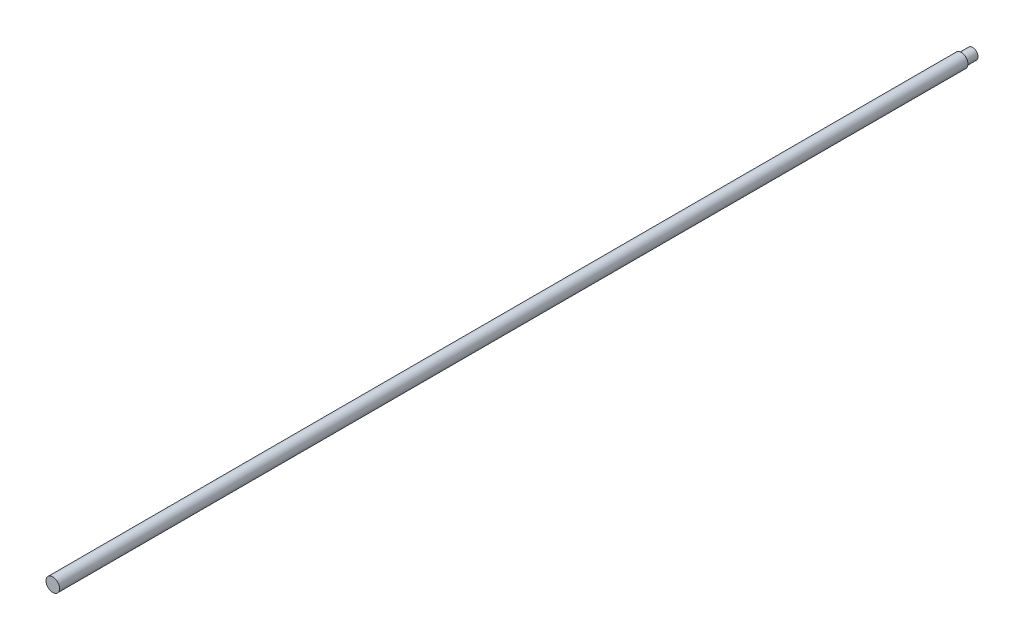
from build123d import *

# Parameters (mm, degrees)
ESQUISSE1_R               = 2.5
BOSS_EXTRU_1_DEPTH        = 340
ESQUISSE2_OUTSIDE_W       = 75.014
ESQUISSE2_OUTSIDE_H       = 75.014
ESQUISSE2_OUTSIDE_R       = 2
ENL_V_MAT_EXTRU_1_DEPTH   = 4.2
TROU_TARAUD_M3X0_51_D     = 2.5
TROU_TARAUD_M3X0_51_DEPTH = 8.5
TROU_TARAUD_M3X0_51_TIP   = 0.751075774


with BuildPart() as part:
    # Esquisse1 → Boss.-Extru.1 (new body)
    with BuildSketch(Plane.XY):
        Circle(ESQUISSE1_R)
    extrude(amount=BOSS_EXTRU_1_DEPTH)

    # Esquisse2 outside → Enlèv. mat.-Extru.1 (cut)
    with BuildSketch(Plane(origin=(0, 0, 0), x_dir=(-1, 0, 0), z_dir=(0, 0, -1))):
        Rectangle(ESQUISSE2_OUTSIDE_W, ESQUISSE2_OUTSIDE_H)
        Circle(ESQUISSE2_OUTSIDE_R, mode=Mode.SUBTRACT)
    extrude(amount=-ENL_V_MAT_EXTRU_1_DEPTH, mode=Mode.SUBTRACT)

    # Trou taraudé M3x0.51
    with Locations(Plane(origin=(0, 0, 0), x_dir=(-1, 0, 0), z_dir=(0, 0, -1))):
        with Locations((0, 0)):
            Hole(TROU_TARAUD_M3X0_51_D / 2, depth=TROU_TARAUD_M3X0_51_DEPTH)
            with Locations((0, 0, -(TROU_TARAUD_M3X0_51_DEPTH + TROU_TARAUD_M3X0_51_TIP / 2))):  # 118° drill point
                Cone(0, TROU_TARAUD_M3X0_51_D / 2, TROU_TARAUD_M3X0_51_TIP, mode=Mode.SUBTRACT)


solid = part.part
